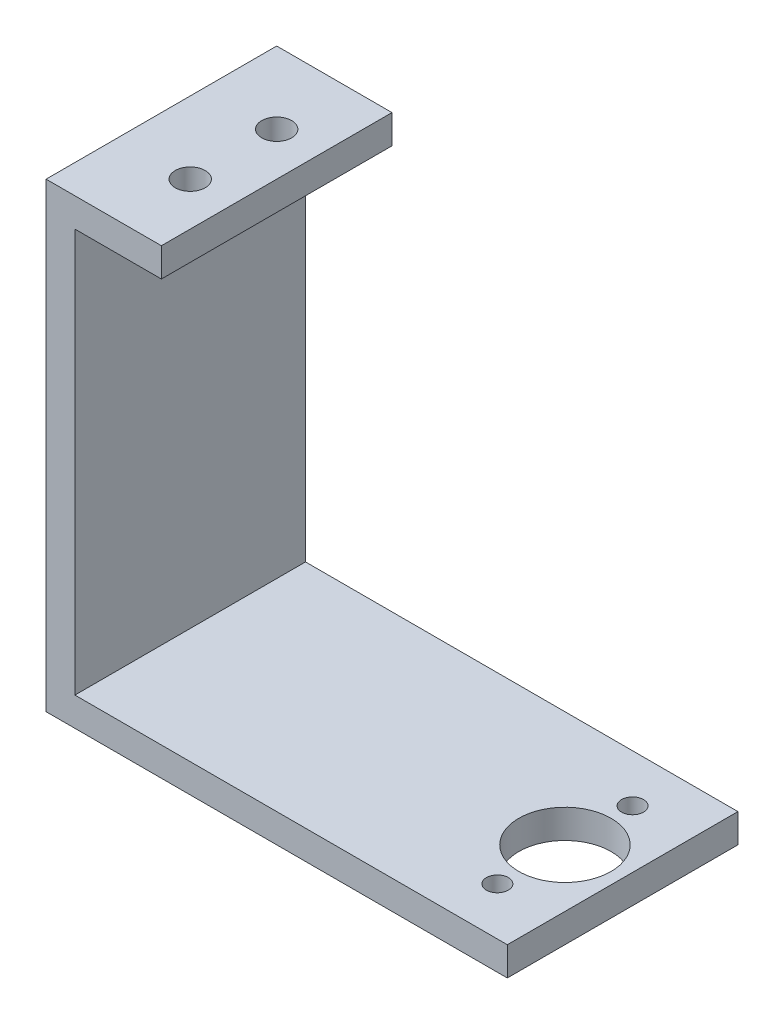
from build123d import *

# Parameters (mm, degrees)
BOSS_EXTRUDE1_DEPTH       = 25.4
M4X0_7_TAPPED_HOLE1_D     = 3.3
M4X0_7_TAPPED_HOLE1_DEPTH = 9.906
M4X0_7_TAPPED_HOLE1_TIP   = 0.991420021
CUT_EXTRUDE1_REACH        = 66.12
SKETCH7_R                 = 5.08
SKETCH7_R_2               = 1.2065


with BuildPart() as part:
    # Sketch1 → Boss-Extrude1 (new body)
    with BuildSketch(Plane.XY):
        Polygon((-17.059275079, 26.987213855), (-29.759275079, 26.987213855), (-29.759275079, -23.812786145), (21.040724921, -23.812786145), (21.040724921, -20.637786145), (-26.584275079, -20.637786145), (-26.584275079, 23.812213855), (-17.059275079, 23.812213855), align=None)
    extrude(amount=BOSS_EXTRUDE1_DEPTH)

    # M4x0.7 Tapped Hole1
    with Locations(Plane(origin=(0, 26.987213855, 0), x_dir=(1, 0, 0), z_dir=(0, 1, 0))):
        with Locations((-21.821775079, -7.9375), (-21.821775079, -17.4625)):
            Hole(M4X0_7_TAPPED_HOLE1_D / 2, depth=M4X0_7_TAPPED_HOLE1_DEPTH)
            with Locations((0, 0, -(M4X0_7_TAPPED_HOLE1_DEPTH + M4X0_7_TAPPED_HOLE1_TIP / 2))):  # 118° drill point
                Cone(0, M4X0_7_TAPPED_HOLE1_D / 2, M4X0_7_TAPPED_HOLE1_TIP, mode=Mode.SUBTRACT)

    # Sketch7 → Cut-Extrude1 (cut, up to next)
    with BuildSketch(Plane.XZ.offset(23.812786145), mode=Mode.PRIVATE) as cut_extrude1_sk1:
        with Locations(Location((14.690724921, 12.7, 0), (0, 0, 270))):
            Circle(SKETCH7_R)
    cut_extrude1_tool1 = extrude(cut_extrude1_sk1.sketch, amount=-CUT_EXTRUDE1_REACH, mode=Mode.PRIVATE) & part.part
    # Sketch7 → Cut-Extrude1 (cut, up to next)
    with BuildSketch(Plane.XZ.offset(23.812786145), mode=Mode.PRIVATE) as cut_extrude1_sk2:
        with Locations(Location((14.690724921, 5.2578, 0), (0, 0, 270))):
            Circle(SKETCH7_R_2)
    cut_extrude1_tool2 = extrude(cut_extrude1_sk2.sketch, amount=-CUT_EXTRUDE1_REACH, mode=Mode.PRIVATE) & part.part
    # Sketch7 → Cut-Extrude1 (cut, up to next)
    with BuildSketch(Plane.XZ.offset(23.812786145), mode=Mode.PRIVATE) as cut_extrude1_sk3:
        with Locations(Location((14.690724921, 20.1422, 0), (0, 0, 270))):
            Circle(SKETCH7_R_2)
    cut_extrude1_tool3 = extrude(cut_extrude1_sk3.sketch, amount=-CUT_EXTRUDE1_REACH, mode=Mode.PRIVATE) & part.part
    add(cut_extrude1_tool1.solids().sort_by_distance((14.690725, -23.812786, 12.7))[0], mode=Mode.SUBTRACT)
    add(cut_extrude1_tool2.solids().sort_by_distance((14.690725, -23.812786, 5.2578))[0], mode=Mode.SUBTRACT)
    add(cut_extrude1_tool3.solids().sort_by_distance((14.690725, -23.812786, 20.1422))[0], mode=Mode.SUBTRACT)


solid = part.part
